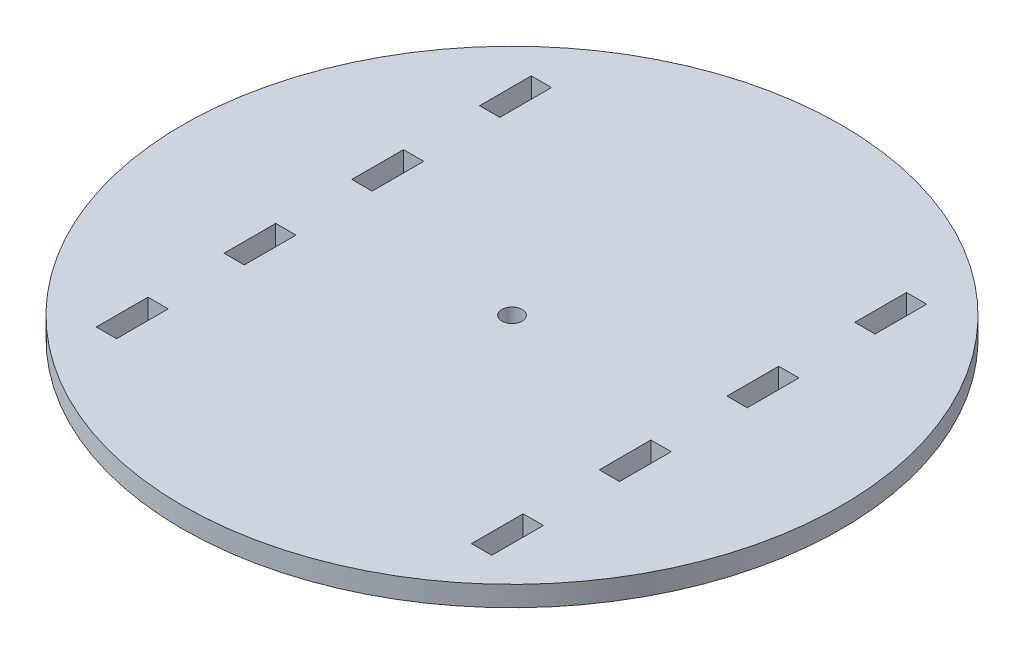
from build123d import *

# Parameters (mm, degrees)
CROQUIS2_R              = 65
SALIENTE_EXTRUIR1_DEPTH = 4
CORTAR_EXTRUIR6_REACH   = 94.011
CROQUIS3_W              = 4
CROQUIS3_H              = 10.2
CROQUIS4_R              = 2
CORTAR_EXTRUIR7_DEPTH   = 10


with BuildPart() as part:
    # Croquis2 → Saliente-Extruir1 (new body)
    with BuildSketch(Plane(origin=(0, 0, 0), x_dir=(1, 0, 0), z_dir=(0, 1, 0))):
        with Locations(Location((0, 0, 0), (0, 0, 270))):
            Circle(CROQUIS2_R)
    extrude(amount=SALIENTE_EXTRUIR1_DEPTH)

    # Croquis3 → Cortar-Extruir6 (cut, up to next)
    with BuildSketch(Plane(origin=(0, 4, 0), x_dir=(1, 0, 0), z_dir=(0, 1, 0)), mode=Mode.PRIVATE) as cortar_extruir6_sk1:
        with Locations((-37, 12.5)):
            Rectangle(CROQUIS3_W, CROQUIS3_H)
    cortar_extruir6_tool1 = extrude(cortar_extruir6_sk1.sketch, amount=-CORTAR_EXTRUIR6_REACH, mode=Mode.PRIVATE) & part.part
    # Croquis3 → Cortar-Extruir6 (cut, up to next)
    with BuildSketch(Plane(origin=(0, 4, 0), x_dir=(1, 0, 0), z_dir=(0, 1, 0)), mode=Mode.PRIVATE) as cortar_extruir6_sk2:
        with Locations((-37, -12.7)):
            Rectangle(CROQUIS3_W, CROQUIS3_H)
    cortar_extruir6_tool2 = extrude(cortar_extruir6_sk2.sketch, amount=-CORTAR_EXTRUIR6_REACH, mode=Mode.PRIVATE) & part.part
    # Croquis3 → Cortar-Extruir6 (cut, up to next)
    with BuildSketch(Plane(origin=(0, 4, 0), x_dir=(1, 0, 0), z_dir=(0, 1, 0)), mode=Mode.PRIVATE) as cortar_extruir6_sk3:
        with Locations((-37, -37.9)):
            Rectangle(CROQUIS3_W, CROQUIS3_H)
    cortar_extruir6_tool3 = extrude(cortar_extruir6_sk3.sketch, amount=-CORTAR_EXTRUIR6_REACH, mode=Mode.PRIVATE) & part.part
    # Croquis3 → Cortar-Extruir6 (cut, up to next)
    with BuildSketch(Plane(origin=(0, 4, 0), x_dir=(1, 0, 0), z_dir=(0, 1, 0)), mode=Mode.PRIVATE) as cortar_extruir6_sk4:
        with Locations((-37, 37.7)):
            Rectangle(CROQUIS3_W, CROQUIS3_H)
    cortar_extruir6_tool4 = extrude(cortar_extruir6_sk4.sketch, amount=-CORTAR_EXTRUIR6_REACH, mode=Mode.PRIVATE) & part.part
    # Croquis3 → Cortar-Extruir6 (cut, up to next)
    with BuildSketch(Plane(origin=(0, 4, 0), x_dir=(1, 0, 0), z_dir=(0, 1, 0)), mode=Mode.PRIVATE) as cortar_extruir6_sk5:
        with Locations((37, 37.7)):
            Rectangle(CROQUIS3_W, CROQUIS3_H)
    cortar_extruir6_tool5 = extrude(cortar_extruir6_sk5.sketch, amount=-CORTAR_EXTRUIR6_REACH, mode=Mode.PRIVATE) & part.part
    # Croquis3 → Cortar-Extruir6 (cut, up to next)
    with BuildSketch(Plane(origin=(0, 4, 0), x_dir=(1, 0, 0), z_dir=(0, 1, 0)), mode=Mode.PRIVATE) as cortar_extruir6_sk6:
        with Locations((37, 12.5)):
            Rectangle(CROQUIS3_W, CROQUIS3_H)
    cortar_extruir6_tool6 = extrude(cortar_extruir6_sk6.sketch, amount=-CORTAR_EXTRUIR6_REACH, mode=Mode.PRIVATE) & part.part
    # Croquis3 → Cortar-Extruir6 (cut, up to next)
    with BuildSketch(Plane(origin=(0, 4, 0), x_dir=(1, 0, 0), z_dir=(0, 1, 0)), mode=Mode.PRIVATE) as cortar_extruir6_sk7:
        with Locations((37, -12.7)):
            Rectangle(CROQUIS3_W, CROQUIS3_H)
    cortar_extruir6_tool7 = extrude(cortar_extruir6_sk7.sketch, amount=-CORTAR_EXTRUIR6_REACH, mode=Mode.PRIVATE) & part.part
    # Croquis3 → Cortar-Extruir6 (cut, up to next)
    with BuildSketch(Plane(origin=(0, 4, 0), x_dir=(1, 0, 0), z_dir=(0, 1, 0)), mode=Mode.PRIVATE) as cortar_extruir6_sk8:
        with Locations((37, -37.9)):
            Rectangle(CROQUIS3_W, CROQUIS3_H)
    cortar_extruir6_tool8 = extrude(cortar_extruir6_sk8.sketch, amount=-CORTAR_EXTRUIR6_REACH, mode=Mode.PRIVATE) & part.part
    add(cortar_extruir6_tool1.solids().sort_by_distance((-37, 4, -12.5))[0], mode=Mode.SUBTRACT)
    add(cortar_extruir6_tool2.solids().sort_by_distance((-37, 4, 12.7))[0], mode=Mode.SUBTRACT)
    add(cortar_extruir6_tool3.solids().sort_by_distance((-37, 4, 37.9))[0], mode=Mode.SUBTRACT)
    add(cortar_extruir6_tool4.solids().sort_by_distance((-37, 4, -37.7))[0], mode=Mode.SUBTRACT)
    add(cortar_extruir6_tool5.solids().sort_by_distance((37, 4, -37.7))[0], mode=Mode.SUBTRACT)
    add(cortar_extruir6_tool6.solids().sort_by_distance((37, 4, -12.5))[0], mode=Mode.SUBTRACT)
    add(cortar_extruir6_tool7.solids().sort_by_distance((37, 4, 12.7))[0], mode=Mode.SUBTRACT)
    add(cortar_extruir6_tool8.solids().sort_by_distance((37, 4, 37.9))[0], mode=Mode.SUBTRACT)

    # Croquis4 → Cortar-Extruir7 (cut)
    with BuildSketch(Plane(origin=(0, 4, 0), x_dir=(1, 0, 0), z_dir=(0, 1, 0))):
        with Locations(Location((0, 0, 0), (0, 0, 270))):
            Circle(CROQUIS4_R)
    extrude(amount=-CORTAR_EXTRUIR7_DEPTH, mode=Mode.SUBTRACT)


solid = part.part
